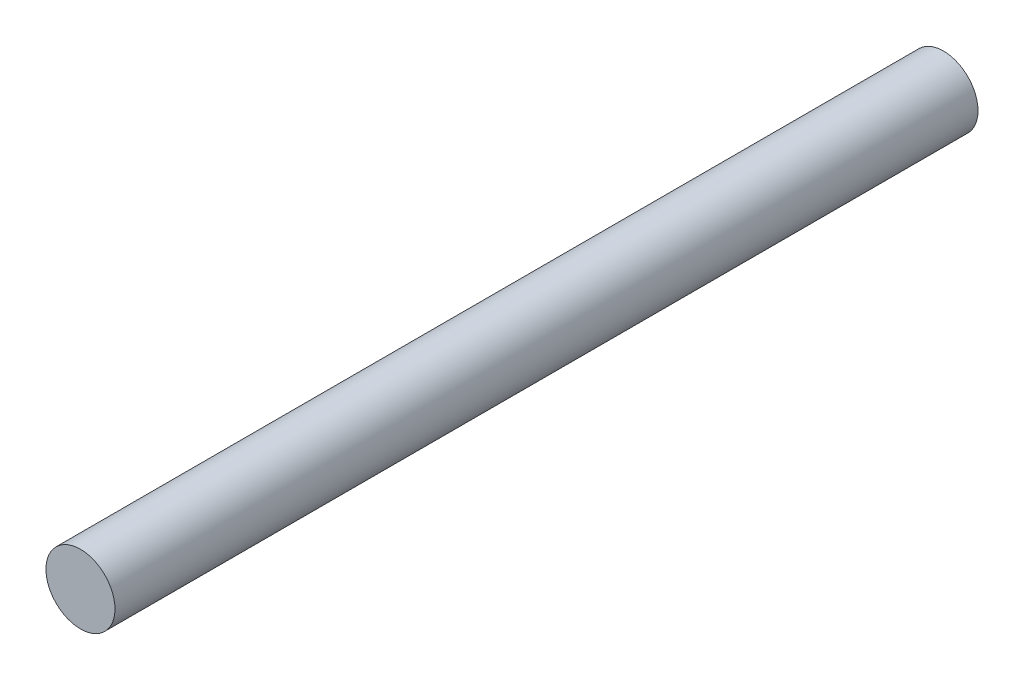
from build123d import *

# Parameters (mm, degrees)
SKETCH1_R           = 0.4
BOSS_EXTRUDE1_DEPTH = 10


with BuildPart() as part:
    # Sketch1 → Boss-Extrude1 (new body)
    with BuildSketch(Plane.XY):
        with Locations((-0.429970965, 0.487207359)):
            Circle(SKETCH1_R)
    extrude(amount=BOSS_EXTRUDE1_DEPTH)


solid = part.part
